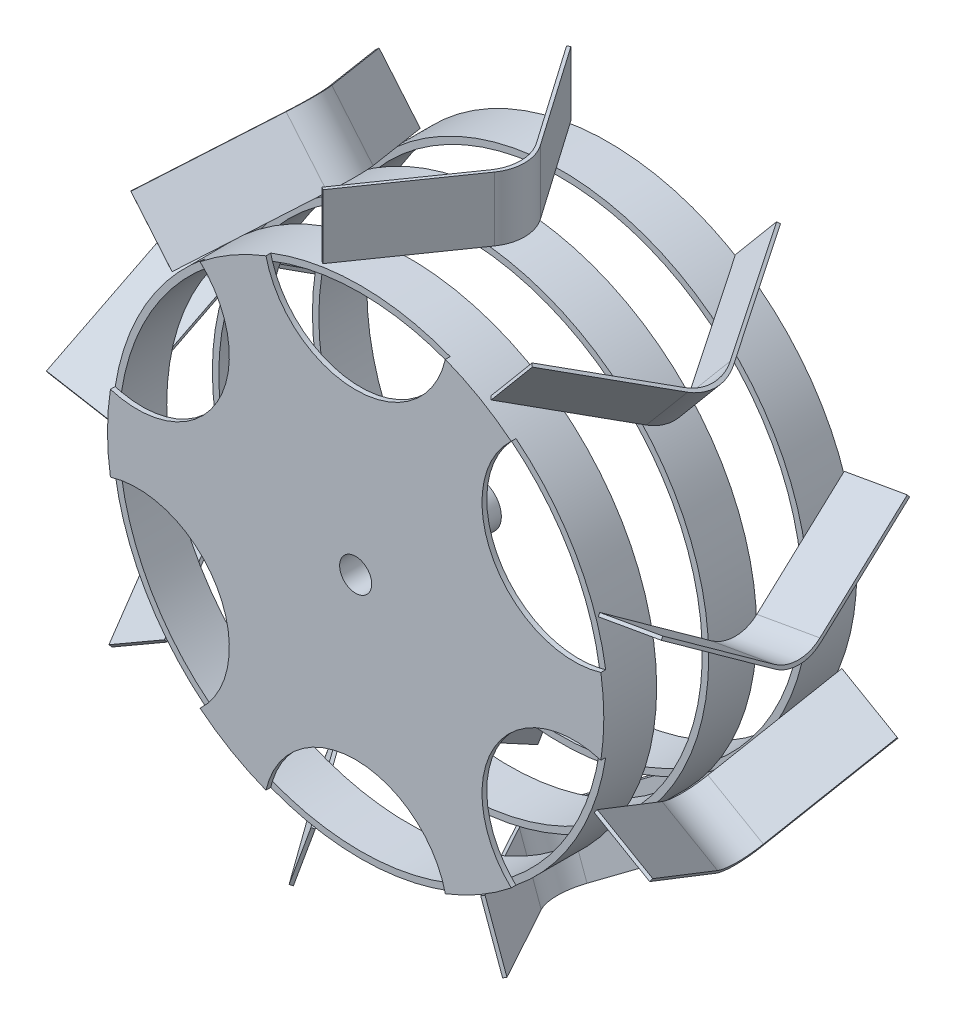
from build123d import *
from build123d.topology import SkipClean

# Parameters (mm, degrees)
EXTRUDE_1_DEPTH                 = 3
SKETCH_2_R                      = 14
CUT_EXTRUDE_1_DEPTH             = 3
EXTRUDE_2_DEPTH                 = 74
EXTRUDE_2_DEPTH_BACK            = 3
SKETCH_2_4_R                    = 14
SKETCH_2_4_R_2                  = 10
CUT_EXTRUDE_2_REACH             = 227.48
SKETCH_4_R                      = 4
CUT_EXTRUDE_2_DIRECTION_2_REACH = 227.48
SKETCH_5_R                      = 155
SKETCH_5_R_2                    = 151
EXTRUDE_3_DEPTH                 = 30
EXTRUDE_4_DEPTH                 = 15
EXTRUDE_4_DEPTH_BACK            = 15
SKETCH_7_R                      = 155
SKETCH_7_R_2                    = 151
SKETCH_6_R                      = 155
SKETCH_6_R_2                    = 151
EXTRUDE_5_DEPTH                 = 30
EXTRUDE_6_DEPTH                 = 40
PATTERN_CIRCULAR_5_COUNT        = 9


with BuildPart() as part:
    # Эскиз1 → Бобышка-Вытянуть1 (new body)
    with BuildSketch(Plane.XY):
        with BuildLine():
            ThreePointArc((-56.016680379, 144.523809524), (-77.5, 134.233937587), (-97.15295031, 120.773773006))
            ThreePointArc((-97.15295031, 120.773773006), (-86.602540378, 50), (-153.169630689, 23.750036518))
            ThreePointArc((-153.169630689, 23.750036518), (-155, 0), (-153.169630689, -23.750036518))
            ThreePointArc((-153.169630689, -23.750036518), (-86.602540378, -50), (-97.15295031, -120.773773006))
            ThreePointArc((-97.15295031, -120.773773006), (-77.5, -134.233937587), (-56.016680379, -144.523809524))
            ThreePointArc((-56.016680379, -144.523809524), (0, -100), (56.016680379, -144.523809524))
            ThreePointArc((56.016680379, -144.523809524), (77.5, -134.233937587), (97.15295031, -120.773773006))
            ThreePointArc((97.15295031, -120.773773006), (86.602540378, -50), (153.169630689, -23.750036518))
            ThreePointArc((153.169630689, -23.750036518), (155, 0), (153.169630689, 23.750036518))
            ThreePointArc((153.169630689, 23.750036518), (86.602540378, 50), (97.15295031, 120.773773006))
            ThreePointArc((97.15295031, 120.773773006), (77.5, 134.233937587), (56.016680379, 144.523809524))
            ThreePointArc((56.016680379, 144.523809524), (0, 100), (-56.016680379, 144.523809524))
        make_face()
    extrude(amount=-EXTRUDE_1_DEPTH)

    # Эскиз2 → Вырез-Вытянуть1 (cut)
    with BuildSketch(Plane(origin=(0, 0, -3), x_dir=(-1, 0, 0), z_dir=(0, 0, -1))):
        Circle(SKETCH_2_R)
    extrude(amount=-CUT_EXTRUDE_1_DEPTH, mode=Mode.SUBTRACT)

    # Эскиз2<4> → Бобышка-Вытянуть2 (add, two sides: drawn at the far end of the back side and taken through both)
    with BuildSketch(Plane(origin=(0, 0, -3), x_dir=(-1, 0, 0), z_dir=(0, 0, -1)).offset(-EXTRUDE_2_DEPTH_BACK)):
        Circle(SKETCH_2_4_R)
        Circle(SKETCH_2_4_R_2, mode=Mode.SUBTRACT)
    extrude(amount=EXTRUDE_2_DEPTH + EXTRUDE_2_DEPTH_BACK)

    # Эскиз4 → Вырез-Вытянуть2 (cut, up to next)
    with BuildSketch(Plane(origin=(0, 0, 0), x_dir=(1, 0, 0), z_dir=(0, 1, 0)), mode=Mode.PRIVATE) as cut_extrude_2_sk1:
        with Locations((0, 56.5)):
            Circle(SKETCH_4_R)
    cut_extrude_2_tool1 = extrude(cut_extrude_2_sk1.sketch, amount=-CUT_EXTRUDE_2_REACH, mode=Mode.PRIVATE) & part.part
    add(cut_extrude_2_tool1.solids().sort_by_distance((0, 0, -56.5))[0], mode=Mode.SUBTRACT)

    # Эскиз4 → Вырез-Вытянуть2 direction 2 (cut, up to next)
    with BuildSketch(Plane(origin=(0, 0, 0), x_dir=(1, 0, 0), z_dir=(0, 1, 0)), mode=Mode.PRIVATE) as cut_extrude_2_direction_2_sk1:
        with Locations((0, 56.5)):
            Circle(SKETCH_4_R)
    cut_extrude_2_direction_2_tool1 = extrude(cut_extrude_2_direction_2_sk1.sketch, amount=CUT_EXTRUDE_2_DIRECTION_2_REACH, mode=Mode.PRIVATE) & part.part
    add(cut_extrude_2_direction_2_tool1.solids().sort_by_distance((0, 0, -56.5))[0], mode=Mode.SUBTRACT)

    # Эскиз5 → Бобышка-Вытянуть3 (add)
    with SkipClean():  # the faces are left unmerged after this step: merging them gives an invalid solid
        with BuildSketch(Plane(origin=(0, 0, -3), x_dir=(-1, 0, 0), z_dir=(0, 0, -1))):
            Circle(SKETCH_5_R)
            Circle(SKETCH_5_R_2, mode=Mode.SUBTRACT)
        extrude(amount=EXTRUDE_3_DEPTH)


with BuildPart() as body_2:
    # Эскиз7 → Бобышка-Вытянуть4 (new, two sides: drawn at the far end of the back side and taken through both)
    with BuildSketch(Plane(origin=(0, 0, -80.5), x_dir=(-1, 0, 0), z_dir=(0, 0, -1)).offset(-EXTRUDE_4_DEPTH_BACK)):
        Circle(SKETCH_7_R)
        Circle(SKETCH_7_R_2, mode=Mode.SUBTRACT)
    extrude(amount=EXTRUDE_4_DEPTH + EXTRUDE_4_DEPTH_BACK)


with BuildPart() as body_3:
    # Эскиз6 → Бобышка-Вытянуть5 (new body)
    with BuildSketch(Plane(origin=(0, 0, -128), x_dir=(-1, 0, 0), z_dir=(0, 0, -1))):
        Circle(SKETCH_6_R)
        Circle(SKETCH_6_R_2, mode=Mode.SUBTRACT)
    extrude(amount=EXTRUDE_5_DEPTH)


with BuildPart() as body_4:
    # Эскиз9 → Бобышка-Вытянуть6 (new body)
    with BuildSketch(Plane(origin=(0, 155, 0), x_dir=(1, 0, 0), z_dir=(0, 1, 0))):
        with BuildLine():
            Line((-25.17073311, 4.143369391), (-23.529786299, 3))
            Line((-23.529786299, 3), (20.511835136, 66.207882615))
            ThreePointArc((20.511835136, 66.207882615), (25, 80.5), (20.511835136, 94.792117385))
            Line((20.511835136, 94.792117385), (-23.529786299, 158))
            Line((-23.529786299, 158), (-25.17073311, 156.856630609))
            Line((-25.17073311, 156.856630609), (18.07421804, 94.792117385))
            ThreePointArc((18.07421804, 94.792117385), (22.562382904, 80.5), (18.07421804, 66.207882615))
            Line((18.07421804, 66.207882615), (-25.17073311, 4.143369391))
        make_face()
    extrude(amount=EXTRUDE_6_DEPTH)


with BuildPart() as pattern_circular_5_1:
    # Круговой массив5: pattern copy
    add(body_4.part.rotate(Axis((0, 0, 0), (0, 0, -1)), 1 * 360 / PATTERN_CIRCULAR_5_COUNT))


with BuildPart() as pattern_circular_5_2:
    # Круговой массив5: pattern copy
    add(body_4.part.rotate(Axis((0, 0, 0), (0, 0, -1)), 2 * 360 / PATTERN_CIRCULAR_5_COUNT))


with BuildPart() as pattern_circular_5_3:
    # Круговой массив5: pattern copy
    add(body_4.part.rotate(Axis((0, 0, 0), (0, 0, -1)), 3 * 360 / PATTERN_CIRCULAR_5_COUNT))


with BuildPart() as pattern_circular_5_4:
    # Круговой массив5: pattern copy
    add(body_4.part.rotate(Axis((0, 0, 0), (0, 0, -1)), 4 * 360 / PATTERN_CIRCULAR_5_COUNT))


with BuildPart() as pattern_circular_5_5:
    # Круговой массив5: pattern copy
    add(body_4.part.rotate(Axis((0, 0, 0), (0, 0, -1)), 5 * 360 / PATTERN_CIRCULAR_5_COUNT))


with BuildPart() as pattern_circular_5_6:
    # Круговой массив5: pattern copy
    add(body_4.part.rotate(Axis((0, 0, 0), (0, 0, -1)), 6 * 360 / PATTERN_CIRCULAR_5_COUNT))


with BuildPart() as pattern_circular_5_7:
    # Круговой массив5: pattern copy
    add(body_4.part.rotate(Axis((0, 0, 0), (0, 0, -1)), 7 * 360 / PATTERN_CIRCULAR_5_COUNT))


with BuildPart() as pattern_circular_5_8:
    # Круговой массив5: pattern copy
    add(body_4.part.rotate(Axis((0, 0, 0), (0, 0, -1)), 8 * 360 / PATTERN_CIRCULAR_5_COUNT))


solid = Compound([part.part, body_2.part, body_3.part, body_4.part, pattern_circular_5_1.part, pattern_circular_5_2.part, pattern_circular_5_3.part, pattern_circular_5_4.part, pattern_circular_5_5.part, pattern_circular_5_6.part, pattern_circular_5_7.part, pattern_circular_5_8.part])
